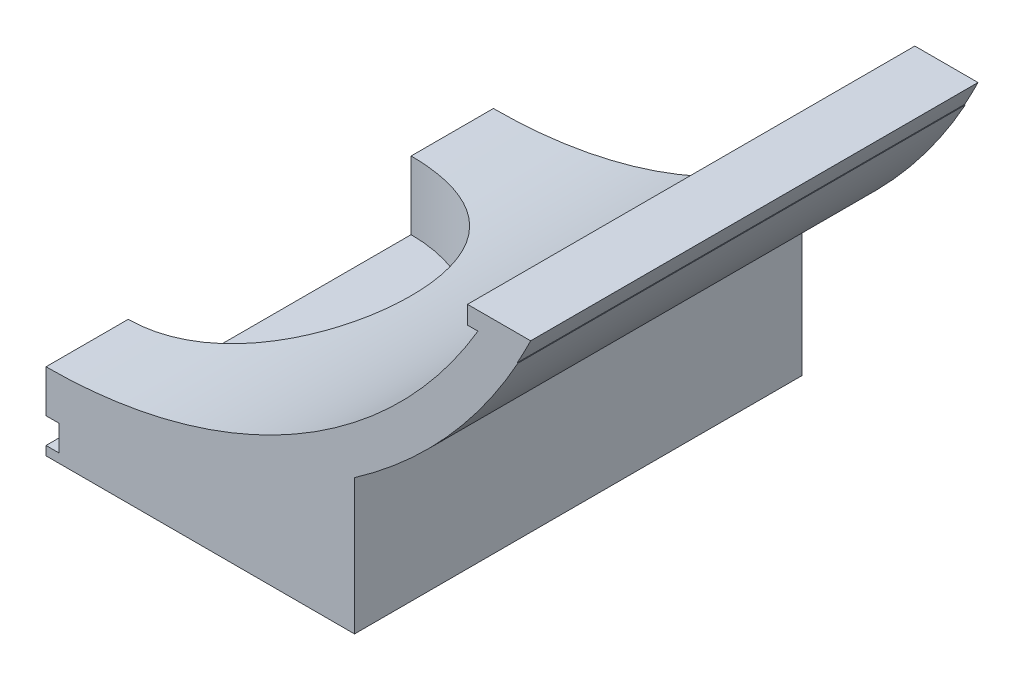
from build123d import *

# Parameters (mm, degrees)
SKETCH_1_R          = 210
SKETCH_1_R_2        = 203
EXTRUDE_2_DEPTH     = 174
EXTRUDE_START       = -174
EXTRUDE_4_DEPTH     = 174
CUT_EXTRUDE_1_DEPTH = 654
EXTRUDE_5_DEPTH     = 174
EXTRUDE_6_DEPTH     = 174
EXTRUDE_7_DEPTH     = 174
EXTRUDE_8_DEPTH     = 174
EXTRUDE_9_DEPTH     = 174
SKETCH_11_R         = 55
CUT_EXTRUDE_4_DEPTH = 221.5
CUT_EXTRUDE_5_DEPTH = 87
SKETCH_13_W         = 252.379443355
SKETCH_13_H         = 197.496269512
CUT_EXTRUDE_6_DEPTH = 244


with BuildPart() as part:
    # 草图1 → 凸台-拉伸2 (new body)
    with BuildSketch(Plane.XY):
        Circle(SKETCH_1_R)
        Circle(SKETCH_1_R_2, mode=Mode.SUBTRACT)
    extrude(amount=EXTRUDE_2_DEPTH)

    # 草图2 → 凸台-拉伸4 (add)
    with BuildSketch(Plane.XY.offset(174).offset(EXTRUDE_START)):
        with BuildLine():
            Line((-170.735431044, -102), (-173.735431044, -102))
            Line((-173.735431044, -102), (-175.513532242, -102))
            ThreePointArc((-175.513532242, -102), (-174.63092392, -103.50381834), (-173.735431044, -105))
            Line((-173.735431044, -105), (-170.735431044, -105))
            Line((-170.735431044, -105), (-170.735431044, -102))
        make_face()
        with BuildLine():
            ThreePointArc((173.735431044, -105), (174.63092392, -103.50381834), (175.513532242, -102))
            Line((175.513532242, -102), (173.735431044, -102))
            Line((173.735431044, -102), (170.735431044, -102))
            Line((170.735431044, -102), (170.735431044, -105))
            Line((170.735431044, -105), (173.735431044, -105))
        make_face()
    extrude(amount=EXTRUDE_4_DEPTH)

    # 草图3 → 切除-拉伸1 (cut)
    with BuildSketch(Plane.XY.offset(174)):
        Polygon((-170.735431044, -102), (238.333646515, -102), (254.334169784, 272.292523591), (-334.569415043, 221.85110305), (-306.830562533, -102), align=None)
    extrude(amount=-CUT_EXTRUDE_1_DEPTH, mode=Mode.SUBTRACT)

    # 草图5 → 凸台-拉伸5 (add)
    with BuildSketch(Plane.XY.offset(174).offset(EXTRUDE_START)):
        with BuildLine():
            Line((-120, -209.75), (-10.243900624, -209.75))
            ThreePointArc((-10.243900624, -209.75), (-67.755470707, -198.769203322), (-120, -172.336879396))
            Line((-120, -172.336879396), (-120, -209.75))
        make_face()
        with BuildLine():
            ThreePointArc((120, -172.336879396), (67.755470707, -198.769203322), (10.243900624, -209.75))
            Line((10.243900624, -209.75), (120, -209.75))
            Line((120, -209.75), (120, -172.336879396))
        make_face()
    extrude(amount=EXTRUDE_5_DEPTH)

    # 草图6 → 凸台-拉伸6 (add)
    with BuildSketch(Plane.XY.offset(174).offset(EXTRUDE_START)):
        with BuildLine():
            Line((-175.513532242, -102), (-166.195667814, -102))
            ThreePointArc((-166.195667814, -102), (0, -195), (166.195667814, -102))
            Line((166.195667814, -102), (175.513532242, -102))
            ThreePointArc((175.513532242, -102), (0, -203), (-175.513532242, -102))
        make_face()
    extrude(amount=EXTRUDE_6_DEPTH)

    # 草图7 → 凸台-拉伸7 (add)
    with BuildSketch(Plane.XY.offset(174).offset(EXTRUDE_START)):
        with BuildLine():
            Line((-166.933126535, -92), (-166.933126535, -95))
            Line((-166.933126535, -95), (-170.293863659, -95))
            ThreePointArc((-170.293863659, -95), (0, -195), (170.293863659, -95))
            Line((170.293863659, -95), (166.933126535, -95))
            Line((166.933126535, -95), (166.933126535, -92))
            Line((166.933126535, -92), (171.933126535, -92))
            Line((171.933126535, -92), (188.496850106, -92))
            ThreePointArc((188.496850106, -92), (0, -209.75), (-188.496850106, -92))
            Line((-188.496850106, -92), (-171.933126535, -92))
            Line((-171.933126535, -92), (-166.933126535, -92))
        make_face()
    extrude(amount=EXTRUDE_7_DEPTH)

    # 草图8 → 凸台-拉伸8 (add)
    with BuildSketch(Plane(origin=(0, 0, 0), x_dir=(-1, 0, 0), z_dir=(0, 0, -1))):
        with BuildLine():
            Line((166.933126535, -92), (163.933126535, -92))
            Line((163.933126535, -92), (163.933126535, -99))
            Line((163.933126535, -99), (168, -99))
            ThreePointArc((168, -99), (169.158755456, -97.006780447), (170.293863659, -95))
            Line((170.293863659, -95), (166.933126535, -95))
            Line((166.933126535, -95), (166.933126535, -92))
        make_face()
        with BuildLine():
            Line((-166.933126535, -95), (-170.293863659, -95))
            ThreePointArc((-170.293863659, -95), (-169.158755456, -97.006780447), (-168, -99))
            Line((-168, -99), (-163.933126535, -99))
            Line((-163.933126535, -99), (-163.933126535, -92))
            Line((-163.933126535, -92), (-166.933126535, -92))
            Line((-166.933126535, -92), (-166.933126535, -95))
        make_face()
    extrude(amount=-EXTRUDE_8_DEPTH)

    # 草图9 → 凸台-拉伸9 (add)
    with BuildSketch(Plane.XY.offset(174).offset(EXTRUDE_START)):
        with BuildLine():
            ThreePointArc((10.243900624, -209.75), (5.123475383, -209.937490697), (0, -210))
            Line((0, -210), (0, -225))
            Line((0, -225), (18.007375678, -225))
            Line((18.007375678, -225), (120, -225))
            Line((120, -225), (120, -209.75))
            Line((120, -209.75), (10.243900624, -209.75))
        make_face()
        with BuildLine():
            Line((0, -225), (0, -210))
            ThreePointArc((0, -210), (-5.123475383, -209.937490697), (-10.243900624, -209.75))
            Line((-10.243900624, -209.75), (-120, -209.75))
            Line((-120, -209.75), (-120, -225))
            Line((-120, -225), (0, -225))
        make_face()
    extrude(amount=EXTRUDE_9_DEPTH)

    # 草图11 → 切除-拉伸4 (cut)
    with BuildSketch(Plane(origin=(0, 0, 0), x_dir=(1, 0, 0), z_dir=(0, 1, 0))):
        with Locations(Location((0, -87, 0), (0, 0, 270))):
            Circle(SKETCH_11_R)
    extrude(amount=-CUT_EXTRUDE_4_DEPTH, mode=Mode.SUBTRACT)

    # 草图10 → 切除-拉伸5 (cut)
    with BuildSketch(Plane.XY.offset(174)):
        Polygon((5, -221.5), (-5, -221.5), (-5, -211.5), (0, -211.5), (5, -211.5), align=None)
    extrude(amount=-CUT_EXTRUDE_5_DEPTH, mode=Mode.SUBTRACT)

    # 草图13 → 切除-拉伸6 (cut)
    with BuildSketch(Plane(origin=(0, 0, 0), x_dir=(0, 0, -1), z_dir=(1, 0, 0))):
        with Locations((-79.30804003, -159.33156324)):
            Rectangle(SKETCH_13_W, SKETCH_13_H)
    extrude(amount=-CUT_EXTRUDE_6_DEPTH, mode=Mode.SUBTRACT)


solid = part.part
